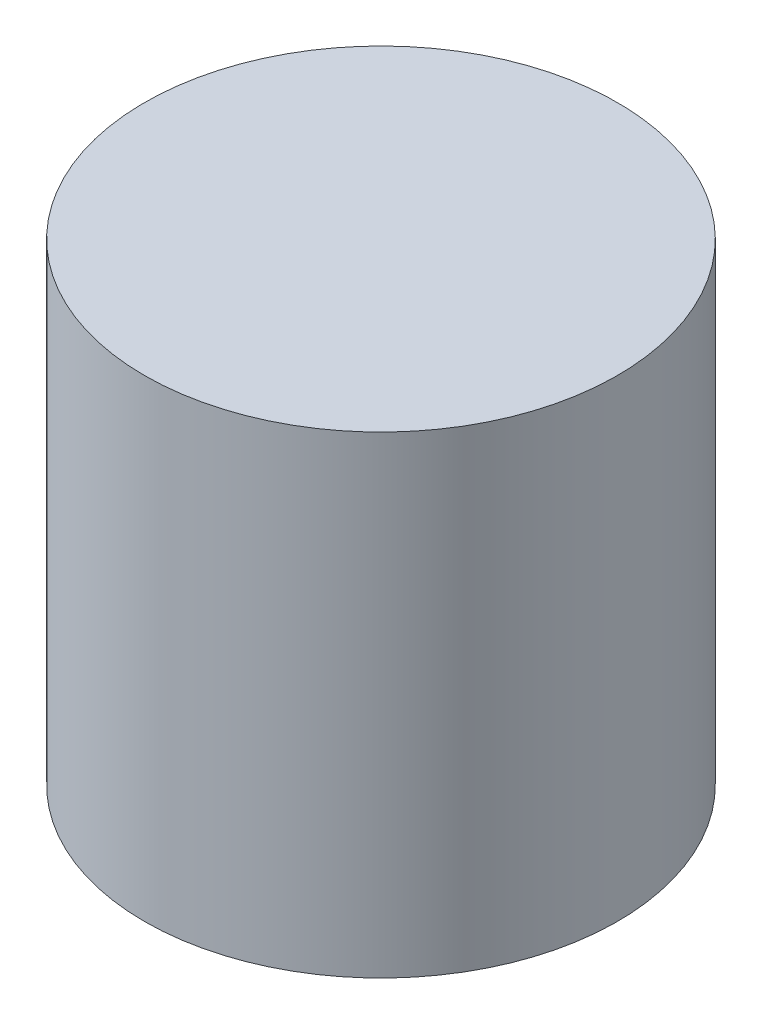
from build123d import *

# Parameters (mm, degrees)
SKETCH_1_R      = 9
EXTRUDE_1_DEPTH = 18


with BuildPart() as part:
    # 草图1 → 凸台-拉伸1 (new body)
    with BuildSketch(Plane(origin=(0, 0, 0), x_dir=(1, 0, 0), z_dir=(0, 1, 0))):
        with Locations(Location((0, 0, 0), (0, 0, 270))):
            Circle(SKETCH_1_R)
    extrude(amount=EXTRUDE_1_DEPTH)


solid = part.part
